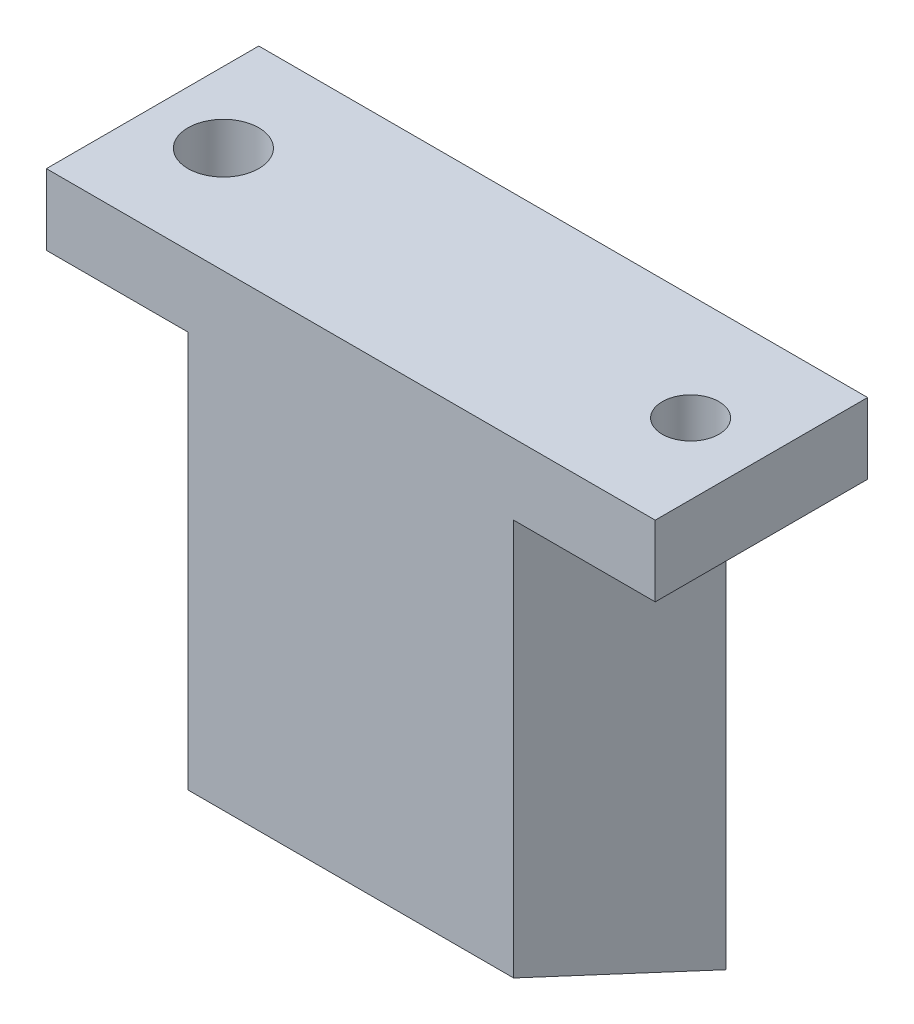
from build123d import *

# Parameters (mm, degrees)
SKETCH1_W           = 23
SKETCH1_H           = 15
BOSS_EXTRUDE1_DEPTH = 40
CUT_EXTRUDE1_DEPTH  = 40
SKETCH3_R           = 1.5
CUT_EXTRUDE2_DEPTH  = 36
SKETCH4_W           = 15
SKETCH4_H           = 5
BOSS_EXTRUDE2_DEPTH = 10
SKETCH5_W           = 15
SKETCH5_H           = 5
BOSS_EXTRUDE3_DEPTH = 10
SKETCH6_R           = 2.5
SKETCH6_R_2         = 2
CUT_EXTRUDE3_DEPTH  = 10


with BuildPart() as part:
    # Sketch1 → Boss-Extrude1 (new body)
    with BuildSketch(Plane(origin=(0, 0, 0), x_dir=(1, 0, 0), z_dir=(0, 1, 0))):
        with Locations((-65.404761905, 8.571428571)):
            Rectangle(SKETCH1_W, SKETCH1_H)
    extrude(amount=BOSS_EXTRUDE1_DEPTH)

    # Sketch2 → Cut-Extrude1 (cut)
    with BuildSketch(Plane(origin=(-53.904761905, 0, 0), x_dir=(0, 0, -1), z_dir=(1, 0, 0))):
        Polygon((16.071428571, 0), (1.071428571, 0), (1.071428571, 6.994614872), align=None)
    extrude(amount=-CUT_EXTRUDE1_DEPTH, mode=Mode.SUBTRACT)

    # Sketch3 → Cut-Extrude2 (cut)
    with BuildSketch(Plane(origin=(0, 6.155714275, -2.870456708), x_dir=(1, 0, 0), z_dir=(0, -0.9063077870366528, 0.4226182617406934))):
        with Locations(Location((-65.378595466, -5.514992079, 0), (0, 0, 270))):
            Circle(SKETCH3_R)
    extrude(amount=-CUT_EXTRUDE2_DEPTH, mode=Mode.SUBTRACT)

    # Sketch4 → Boss-Extrude2 (add)
    with BuildSketch(Plane(origin=(-53.904761905, 0, 0), x_dir=(0, 0, -1), z_dir=(1, 0, 0))):
        with Locations((8.571428571, 37.5)):
            Rectangle(SKETCH4_W, SKETCH4_H)
    extrude(amount=BOSS_EXTRUDE2_DEPTH)

    # Sketch5 → Boss-Extrude3 (add)
    with BuildSketch(Plane.ZY.offset(76.904761905)):
        with Locations((-8.571428571, 37.5)):
            Rectangle(SKETCH5_W, SKETCH5_H)
    extrude(amount=BOSS_EXTRUDE3_DEPTH)

    # Sketch6 → Cut-Extrude3 (cut)
    with BuildSketch(Plane.XZ.offset(-35)):
        with Locations(Location((-81.904761905, -8.571428571, 0), (0, 0, 270))):
            Circle(SKETCH6_R)
        with Locations(Location((-48.904761905, -8.571428571, 0), (0, 0, 270))):
            Circle(SKETCH6_R_2)
    extrude(amount=-CUT_EXTRUDE3_DEPTH, mode=Mode.SUBTRACT)


solid = part.part
